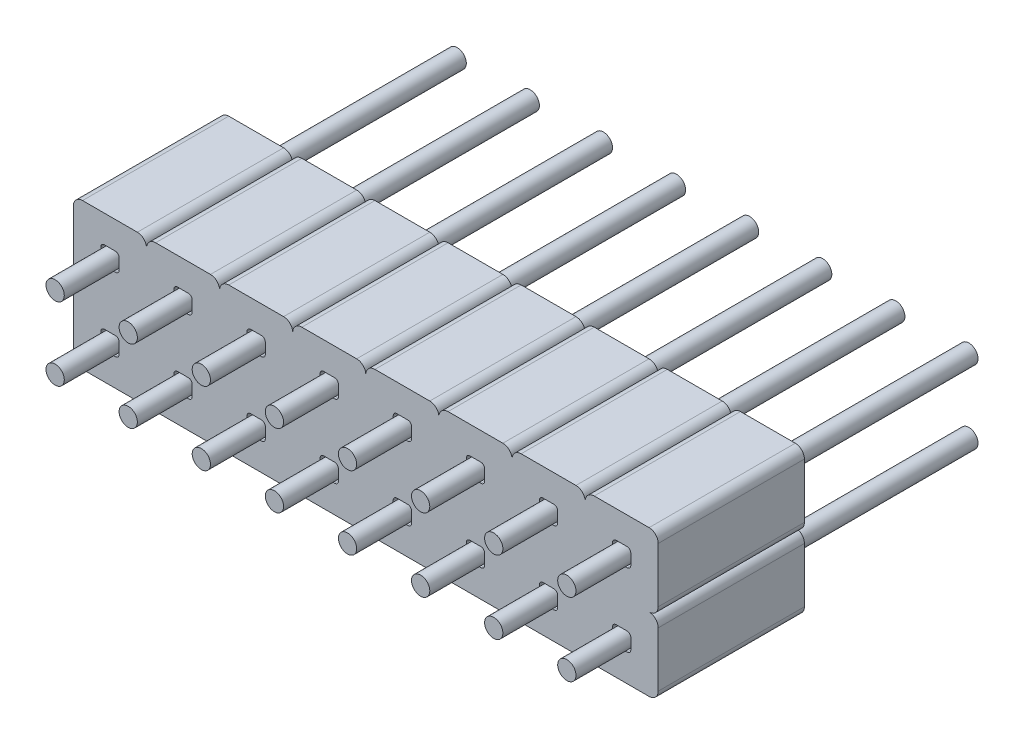
from build123d import *

# Parameters (mm, degrees)
EXTRUDE_1_DEPTH             = 4
PATTERN_LINEAR_2_COUNT      = 8
PATTERN_LINEAR_2_PITCH      = 2
PATTERN_LINEAR_2_COUNT_DIR2 = 2
PATTERN_LINEAR_2_PITCH_DIR2 = 2
SKETCH_3_R                  = 0.25
EXTRUDE_2_DEPTH             = 5.5
PATTERN_LINEAR_3_COUNT      = 8
PATTERN_LINEAR_3_PITCH      = 2
PATTERN_LINEAR_3_COUNT_DIR2 = 2
PATTERN_LINEAR_3_PITCH_DIR2 = 2


with BuildPart() as part:
    # 草图1 → 凸台-拉伸1 (new body)
    with BuildSketch(Plane.XY):
        with BuildLine():
            Line((0.25, 0), (1.75, 0))
            ThreePointArc((1.75, 0), (1.926776695, -0.073223305), (2, -0.25))
            Line((2, -0.25), (2, -1.75))
            ThreePointArc((2, -1.75), (1.926776695, -1.926776695), (1.75, -2))
            Line((1.75, -2), (0.25, -2))
            ThreePointArc((0.25, -2), (0.073223305, -1.926776695), (0, -1.75))
            Line((0, -1.75), (0, -0.25))
            ThreePointArc((0, -0.25), (0.073223305, -0.073223305), (0.25, 0))
        make_face()
        with BuildLine():
            Line((0.85, -0.75), (1.15, -0.75))
            ThreePointArc((1.15, -0.75), (1.220710678, -0.779289322), (1.25, -0.85))
            Line((1.25, -0.85), (1.25, -1.15))
            ThreePointArc((1.25, -1.15), (1.220710678, -1.220710678), (1.15, -1.25))
            Line((1.15, -1.25), (0.85, -1.25))
            ThreePointArc((0.85, -1.25), (0.779289322, -1.220710678), (0.75, -1.15))
            Line((0.75, -1.15), (0.75, -0.85))
            ThreePointArc((0.75, -0.85), (0.779289322, -0.779289322), (0.85, -0.75))
        make_face(mode=Mode.SUBTRACT)
    extrude_1 = extrude(amount=EXTRUDE_1_DEPTH)

    # 阵列(线性)2: Extrude 1 8 × 2
    with Locations(*[(i * PATTERN_LINEAR_2_PITCH, -j * PATTERN_LINEAR_2_PITCH_DIR2, 0) for i in range(PATTERN_LINEAR_2_COUNT) for j in range(PATTERN_LINEAR_2_COUNT_DIR2) if (i, j) != (0, 0)]):
        add(extrude_1)


with BuildPart() as body_2:
    # 草图3 → 凸台-拉伸2 (new, symmetric)
    with BuildSketch(Plane(origin=(0, 0, 0), x_dir=(-1, 0, 0), z_dir=(0, 0, -1))):
        with Locations((-1, -1)):
            Circle(SKETCH_3_R)
    extrude_2 = extrude(amount=EXTRUDE_2_DEPTH, both=True)


with BuildPart() as pattern_linear_3_1:
    # 阵列(线性)3: Extrude 2 8 × 2
    with Locations(*[(i * PATTERN_LINEAR_3_PITCH, -j * PATTERN_LINEAR_3_PITCH_DIR2, 0) for i in range(PATTERN_LINEAR_3_COUNT) for j in range(PATTERN_LINEAR_3_COUNT_DIR2) if (i, j) != (0, 0)]):
        add(extrude_2)


solid = Compound([part.part, body_2.part, pattern_linear_3_1.part])
